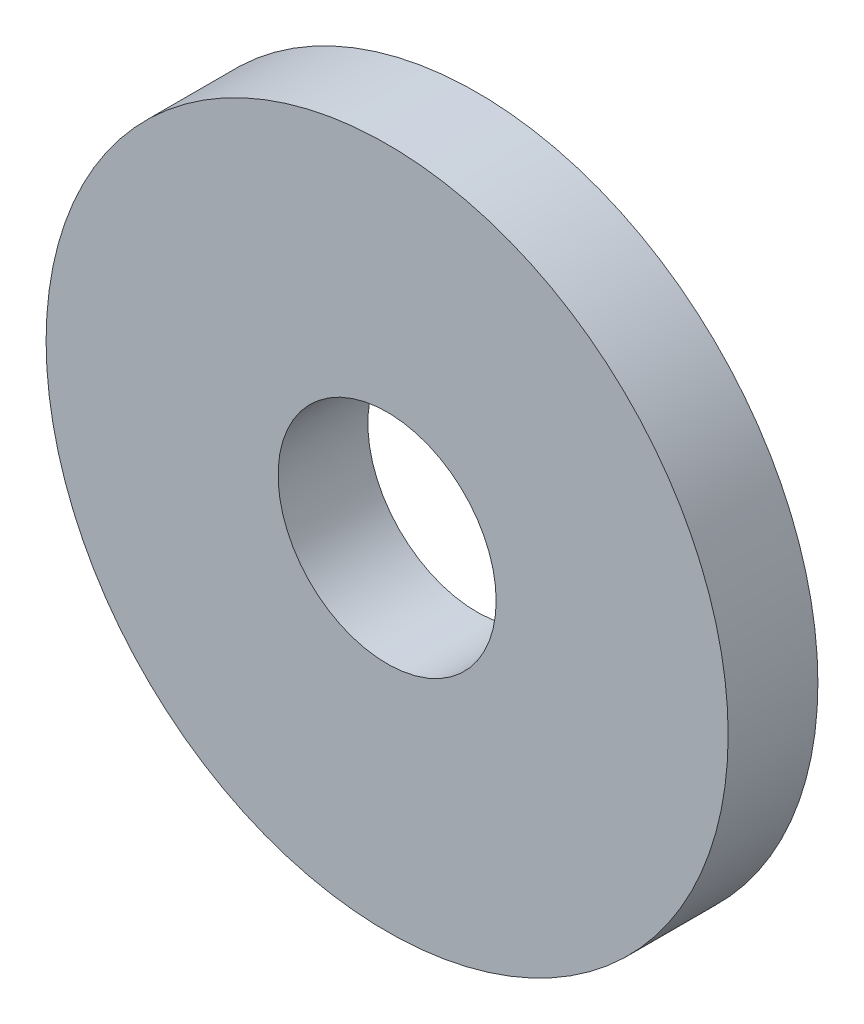
from build123d import *

# Parameters (mm, degrees)
SKIZZE1_R                       = 19
SKIZZE1_R_2                     = 6.075
AUFSATZ_LINEAR_AUSTRAGEN1_DEPTH = 5


with BuildPart() as part:
    # Skizze1 → Aufsatz-Linear austragen1 (new body)
    with BuildSketch(Plane.XY):
        Circle(SKIZZE1_R)
        Circle(SKIZZE1_R_2, mode=Mode.SUBTRACT)
    extrude(amount=AUFSATZ_LINEAR_AUSTRAGEN1_DEPTH)


solid = part.part
